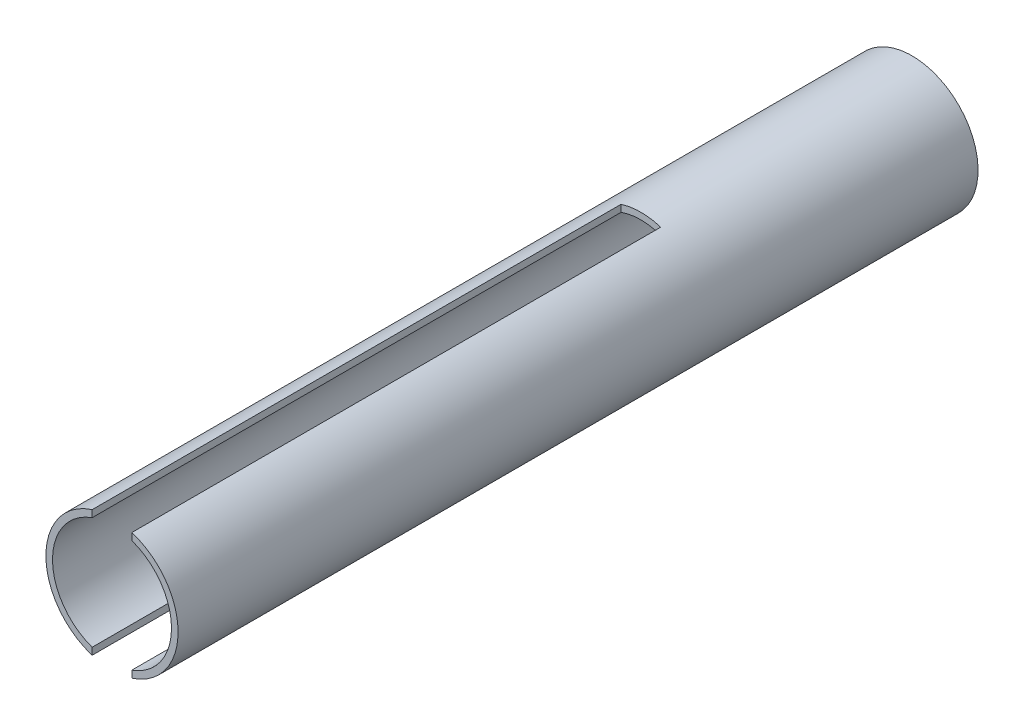
from build123d import *

# Parameters (mm, degrees)
SKETCH1_R           = 25
SKETCH1_R_2         = 22.5
BOSS_EXTRUDE1_DEPTH = 300
SKETCH2_W           = 15
SKETCH2_H           = 7.280738242
CUT_EXTRUDE1_DEPTH  = 200
SKETCH3_R           = 25
BOSS_EXTRUDE2_DEPTH = 2.5


with BuildPart() as part:
    # Sketch1 → Boss-Extrude1 (new body)
    with BuildSketch(Plane.XY):
        Circle(SKETCH1_R)
        Circle(SKETCH1_R_2, mode=Mode.SUBTRACT)
    extrude(amount=-BOSS_EXTRUDE1_DEPTH)

    # Sketch2 → Cut-Extrude1 (cut)
    with BuildSketch(Plane.XY):
        with Locations((0, 23)):
            Rectangle(SKETCH2_W, SKETCH2_H)
    cut_extrude1 = extrude(amount=-CUT_EXTRUDE1_DEPTH, mode=Mode.SUBTRACT)

    # Mirror1: Cut-Extrude1 across plane
    add(cut_extrude1.mirror(Plane.ZX), mode=Mode.SUBTRACT)

    # Sketch3 → Boss-Extrude2 (add)
    with BuildSketch(Plane(origin=(0, 0, -300), x_dir=(-1, 0, 0), z_dir=(0, 0, -1))):
        with Locations(Location((0, 0, 0), (0, 0, 107.457603124))):
            Circle(SKETCH3_R)
    extrude(amount=BOSS_EXTRUDE2_DEPTH)


solid = part.part
